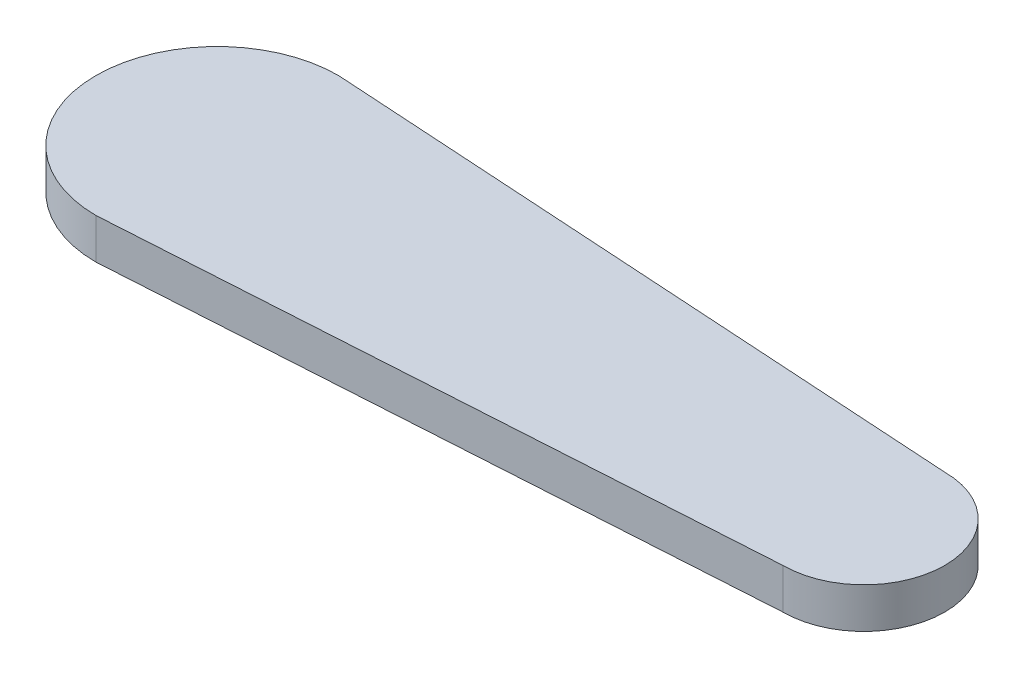
from build123d import *

# Parameters (mm, degrees)
BOSS_EXTRUDE1_DEPTH = 5


with BuildPart() as part:
    # Sketch1 → Boss-Extrude1 (new body)
    with BuildSketch(Plane(origin=(0, 0, 0), x_dir=(1, 0, 0), z_dir=(0, 1, 0))):
        with BuildLine():
            Line((0, 15), (80, 10))
            ThreePointArc((80, 10), (90, 0), (80, -10))
            Line((80, -10), (0, -15))
            ThreePointArc((0, -15), (-15, 0), (0, 15))
        make_face()
    extrude(amount=BOSS_EXTRUDE1_DEPTH)


solid = part.part
